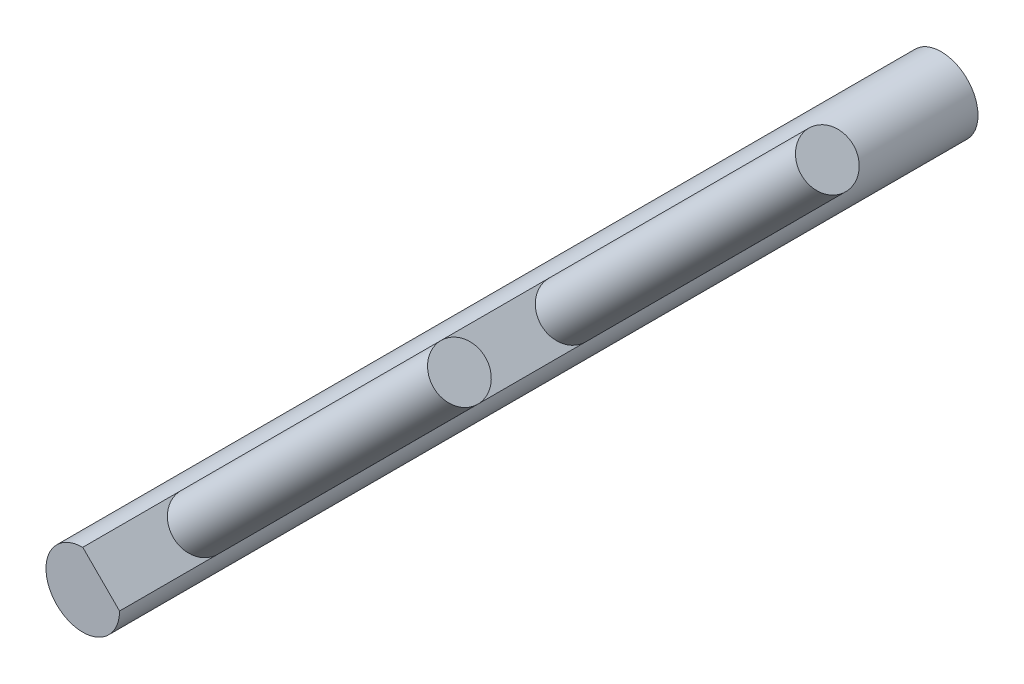
from build123d import *

# Parameters (mm, degrees)
ESQUISSE1_R             = 3
BOSS_EXTRU_1_DEPTH      = 15
ESQUISSE2_R             = 2.5
ENL_V_MAT_EXTRU_1_DEPTH = 5
BOSS_EXTRU_2_DEPTH      = 55
ESQUISSE4_R             = 2.121320344
BOSS_EXTRU_3_DEPTH      = 30


with BuildPart() as part:
    # Esquisse1 → Boss.-Extru.1 (new body)
    with BuildSketch(Plane.XY):
        Circle(ESQUISSE1_R)
    extrude(amount=BOSS_EXTRU_1_DEPTH)

    # Esquisse2 → Enlèv. mat.-Extru.1 (cut)
    with BuildSketch(Plane(origin=(0, 0, 0), x_dir=(-1, 0, 0), z_dir=(0, 0, -1))):
        Circle(ESQUISSE2_R)
    extrude(amount=-ENL_V_MAT_EXTRU_1_DEPTH, mode=Mode.SUBTRACT)

    # Esquisse3 → Boss.-Extru.2 (add)
    with BuildSketch(Plane.XY.offset(15)):
        with BuildLine():
            Line((0, 3), (3, 0))
            ThreePointArc((3, 0), (-2.121320344, -2.121320344), (0, 3))
        make_face()
    extrude(amount=BOSS_EXTRU_2_DEPTH)

    # Esquisse4 → Boss.-Extru.3 (add)
    with BuildSketch(Plane(origin=(1.5, 1.5, 0), x_dir=(0, 0, -1), z_dir=(0.7071067811865477, 0.7071067811865475, 0))):
        with Locations(Location((-62, 0, 0), (0, 0, 90))):
            Circle(ESQUISSE4_R)
        with Locations(Location((-32, 0, 0), (0, 0, 90))):
            Circle(ESQUISSE4_R)
    extrude(amount=BOSS_EXTRU_3_DEPTH)


solid = part.part
